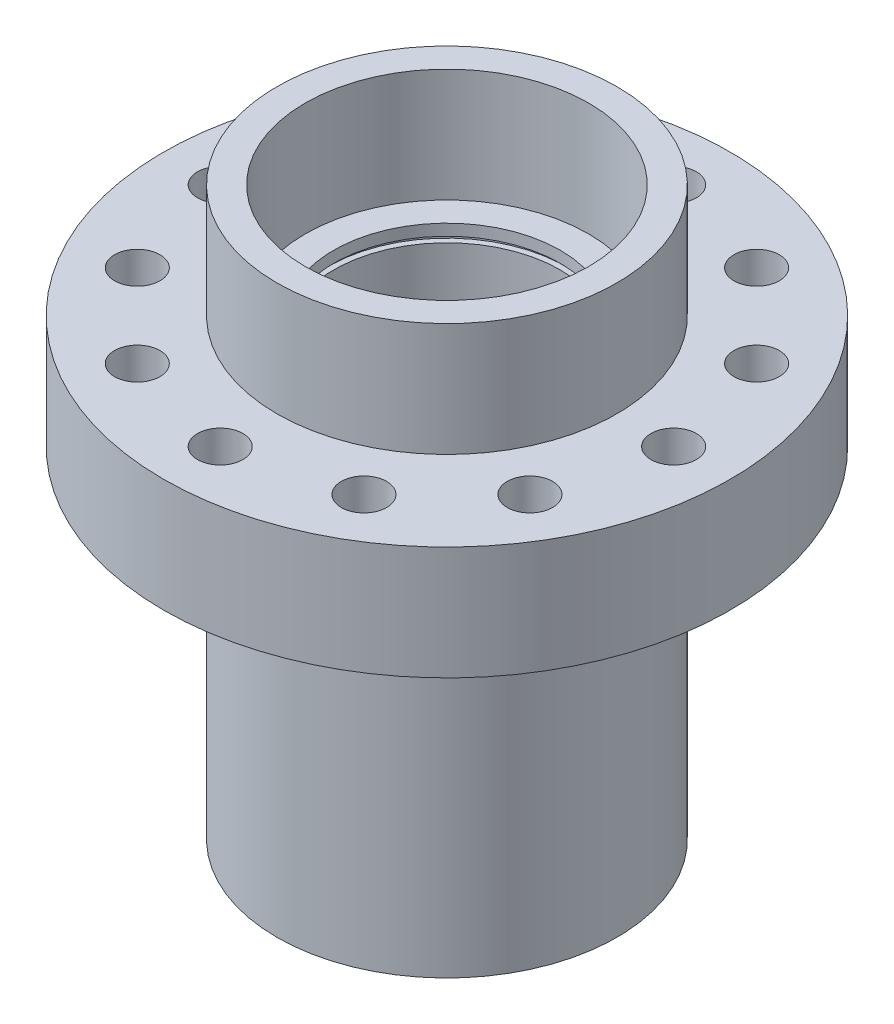
from build123d import *

# Parameters (mm, degrees)
SKETCH2_R           = 4
CUT_EXTRUDE1_DEPTH  = 20
EXTRUDE_THIN1_START = 20
SKETCH3_R           = 30
SKETCH3_R_2         = 25
EXTRUDE_THIN1_DEPTH = 20


with BuildPart() as part:
    # Sketch1 → Revolve1 (revolve)
    with BuildSketch(Plane.XY, mode=Mode.PRIVATE) as revolve1_sk:
        Polygon((50, 80), (20, 80), (20, 78), (21, 78), (21, 77), (20, 77), (20, 65), (10, 65), (10, 15), (20, 15), (20, 3), (21, 3), (21, 2), (20, 2), (20, 0), (30, 0), (30, 60), (50, 60), align=None)
    revolve(revolve1_sk.sketch.rotate(Axis((0, 80, 0), (0, -1, 0)), 90), axis=Axis((0, 80, 0), (0, -1, 0)))

    # Sketch2 → Cut-Extrude1 (cut)
    with BuildSketch(Plane.XZ.offset(-60)):
        with Locations(Location((0, 40, 0), (0, 0, 270))):
            Circle(SKETCH2_R)
        with Locations(Location((20, 34.641016151, 0), (0, 0, 270))):
            Circle(SKETCH2_R)
        with Locations(Location((34.641016151, 20, 0), (0, 0, 270))):
            Circle(SKETCH2_R)
        with Locations(Location((40, 0, 0), (0, 0, 270))):
            Circle(SKETCH2_R)
        with Locations(Location((34.641016151, -20, 0), (0, 0, 270))):
            Circle(SKETCH2_R)
        with Locations(Location((20, -34.641016151, 0), (0, 0, 270))):
            Circle(SKETCH2_R)
        with Locations(Location((0, -40, 0), (0, 0, 270))):
            Circle(SKETCH2_R)
        with Locations(Location((-20, -34.641016151, 0), (0, 0, 270))):
            Circle(SKETCH2_R)
        with Locations(Location((-34.641016151, -20, 0), (0, 0, 270))):
            Circle(SKETCH2_R)
        with Locations(Location((-40, 0, 0), (0, 0, 270))):
            Circle(SKETCH2_R)
        with Locations(Location((-34.641016151, 20, 0), (0, 0, 270))):
            Circle(SKETCH2_R)
        with Locations(Location((-20, 34.641016151, 0), (0, 0, 270))):
            Circle(SKETCH2_R)
    extrude(amount=-CUT_EXTRUDE1_DEPTH, mode=Mode.SUBTRACT)

    # Sketch3 → Extrude-Thin1 (add)
    with BuildSketch(Plane(origin=(0, 80, 0), x_dir=(1, 0, 0), z_dir=(0, 1, 0)).offset(EXTRUDE_THIN1_START)):
        Circle(SKETCH3_R)
        Circle(SKETCH3_R_2, mode=Mode.SUBTRACT)
    extrude(amount=-EXTRUDE_THIN1_DEPTH)


solid = part.part
